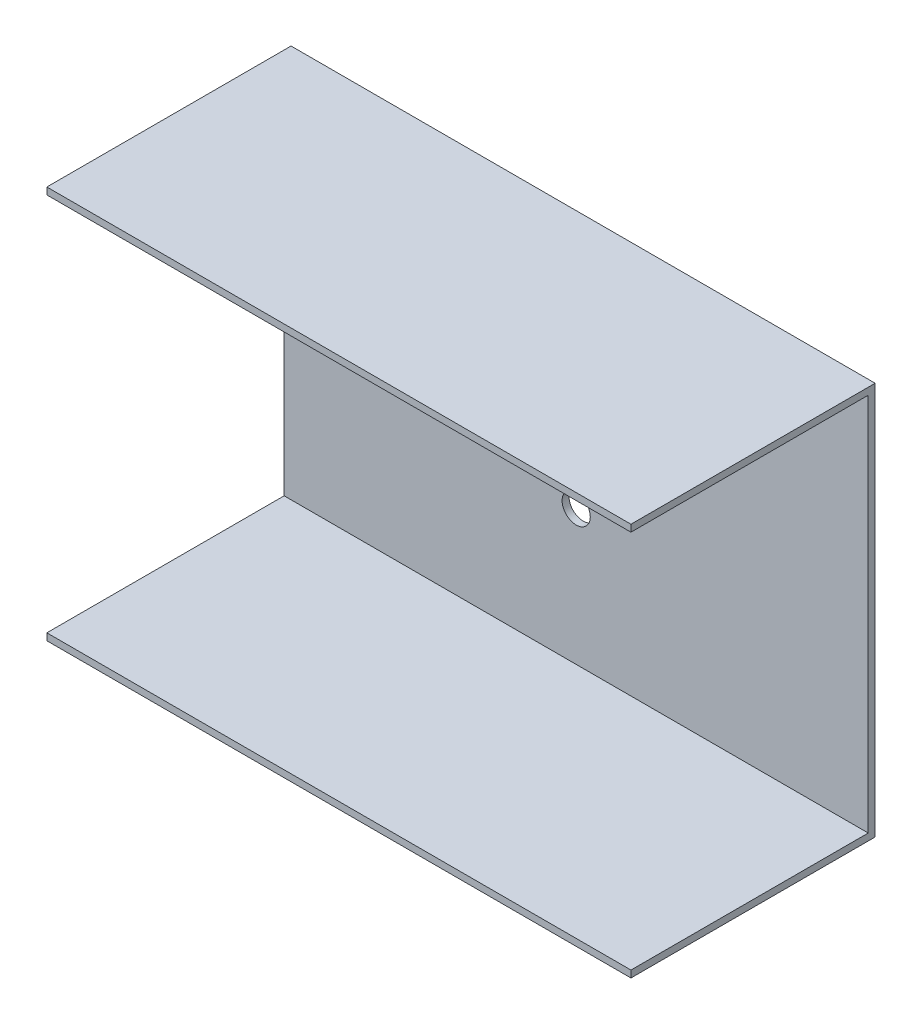
from build123d import *

# Parameters (mm, degrees)
BOSS_EXTRUDE1_DEPTH = 135.3879
SKETCH2_R           = 3.2639
CUT_EXTRUDE1_DEPTH  = 1.6002


with BuildPart() as part:
    # Sketch1 → Boss-Extrude1 (new body)
    with BuildSketch(Plane(origin=(0, 0, 0), x_dir=(0, 0, -1), z_dir=(1, 0, 0))):
        Polygon((0, 0), (0, -1.6002), (55, -1.6002), (55, -89.49088), (0, -89.49088), (0, -91.09108), (56.6002, -91.09108), (56.6002, 0), align=None)
    extrude(amount=BOSS_EXTRUDE1_DEPTH)

    # Sketch2 → Cut-Extrude1 (cut)
    with BuildSketch(Plane.XY.offset(-55)):
        with Locations((67.69395, -32.84554)):
            Circle(SKETCH2_R)
        with Locations((67.69395, -58.24554)):
            Circle(SKETCH2_R)
        with Locations((54.99395, -45.54554)):
            Circle(SKETCH2_R)
        with Locations((80.39395, -45.54554)):
            Circle(SKETCH2_R)
    extrude(amount=-CUT_EXTRUDE1_DEPTH, mode=Mode.SUBTRACT)


solid = part.part
